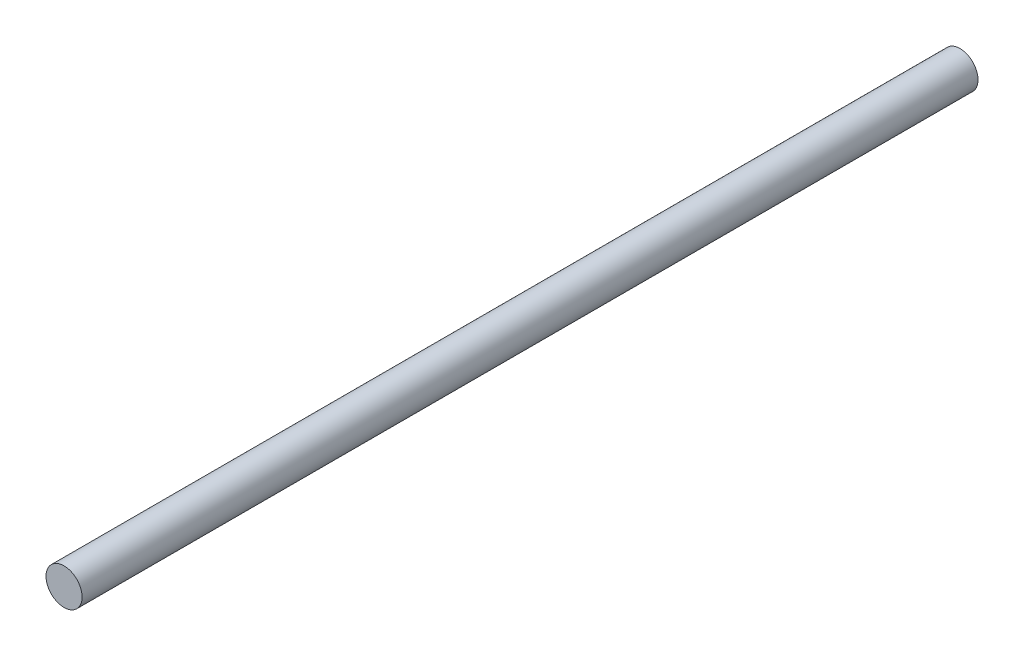
from build123d import *

# Parameters (mm, degrees)
SKETCH1_R           = 4.7625
BOSS_EXTRUDE1_DEPTH = 118.25


with BuildPart() as part:
    # Sketch1 → Boss-Extrude1 (new, symmetric)
    with BuildSketch(Plane.XY):
        with Locations(Location((0, 0, 0), (0, 0, 180))):
            Circle(SKETCH1_R)
    extrude(amount=BOSS_EXTRUDE1_DEPTH, both=True)


solid = part.part
